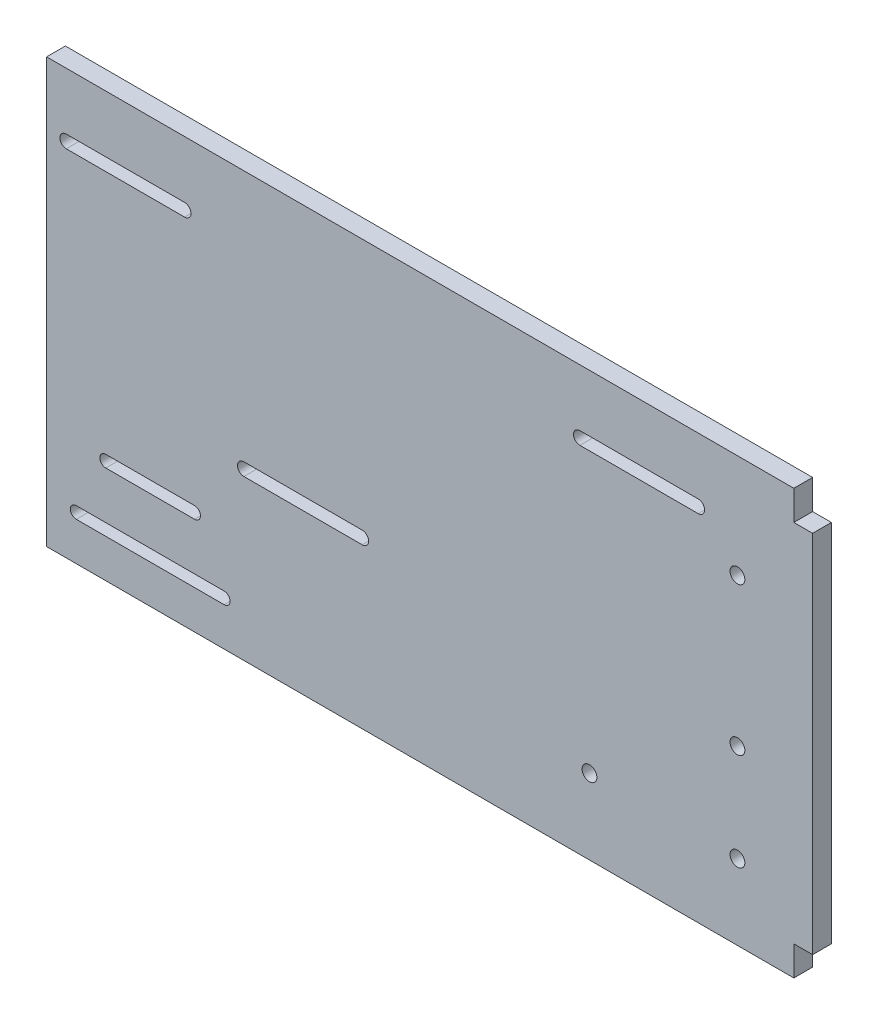
from build123d import *

# Parameters (mm, degrees)
SKETCH3_R           = 2.5
BOSS_EXTRUDE1_DEPTH = 6.35


with BuildPart() as part:
    # Sketch3 → Boss-Extrude1 (new body)
    with BuildSketch(Plane.XY):
        Polygon((244.584917863, 41.962665812), (-7.908318612, 41.962665812), (-7.908318612, -101.354312852), (244.584917863, -101.354312852), (244.584917863, -91.354312852), (250.934917863, -91.354312852), (250.934917863, 31.962665812), (244.584917863, 31.962665812), align=None)
        with Locations((225.534917863, -43.037334188)):
            Circle(SKETCH3_R, mode=Mode.SUBTRACT)
        with Locations((225.534917863, 6.962665812)):
            Circle(SKETCH3_R, mode=Mode.SUBTRACT)
        with Locations((225.534917863, -75.954312852)):
            Circle(SKETCH3_R, mode=Mode.SUBTRACT)
        with Locations((175.534917863, -75.954312852)):
            Circle(SKETCH3_R, mode=Mode.SUBTRACT)
        with BuildLine():
            Line((58.748599203, -43.204312852), (98.748599203, -43.204312852))
            ThreePointArc((98.748599203, -43.204312852), (100.898599203, -45.354312852), (98.748599203, -47.504312852))
            Line((98.748599203, -47.504312852), (58.748599203, -47.504312852))
            ThreePointArc((58.748599203, -47.504312852), (56.598599203, -45.354312852), (58.748599203, -43.204312852))
        make_face(mode=Mode.SUBTRACT)
        with BuildLine():
            Line((-1.261400797, 22.685687148), (38.738599203, 22.685687148))
            ThreePointArc((38.738599203, 22.685687148), (40.888599203, 20.535687148), (38.738599203, 18.385687148))
            Line((38.738599203, 18.385687148), (-1.261400797, 18.385687148))
            ThreePointArc((-1.261400797, 18.385687148), (-3.411400797, 20.535687148), (-1.261400797, 22.685687148))
        make_face(mode=Mode.SUBTRACT)
        with BuildLine():
            Line((172.288599203, 22.685687148), (212.288599203, 22.685687148))
            ThreePointArc((212.288599203, 22.685687148), (214.438599203, 20.535687148), (212.288599203, 18.385687148))
            Line((212.288599203, 18.385687148), (172.288599203, 18.385687148))
            ThreePointArc((172.288599203, 18.385687148), (170.138599203, 20.535687148), (172.288599203, 22.685687148))
        make_face(mode=Mode.SUBTRACT)
        with BuildLine():
            Line((12.091681388, -64.354312852), (42.091681388, -64.354312852))
            ThreePointArc((42.091681388, -64.354312852), (44.091681388, -66.354312852), (42.091681388, -68.354312852))
            Line((42.091681388, -68.354312852), (12.091681388, -68.354312852))
            ThreePointArc((12.091681388, -68.354312852), (10.091681388, -66.354312852), (12.091681388, -64.354312852))
        make_face(mode=Mode.SUBTRACT)
        with BuildLine():
            Line((2.091681388, -84.354312852), (52.091681388, -84.354312852))
            ThreePointArc((52.091681388, -84.354312852), (54.091681388, -86.354312852), (52.091681388, -88.354312852))
            Line((52.091681388, -88.354312852), (2.091681388, -88.354312852))
            ThreePointArc((2.091681388, -88.354312852), (0.091681388, -86.354312852), (2.091681388, -84.354312852))
        make_face(mode=Mode.SUBTRACT)
    extrude(amount=BOSS_EXTRUDE1_DEPTH)


solid = part.part
